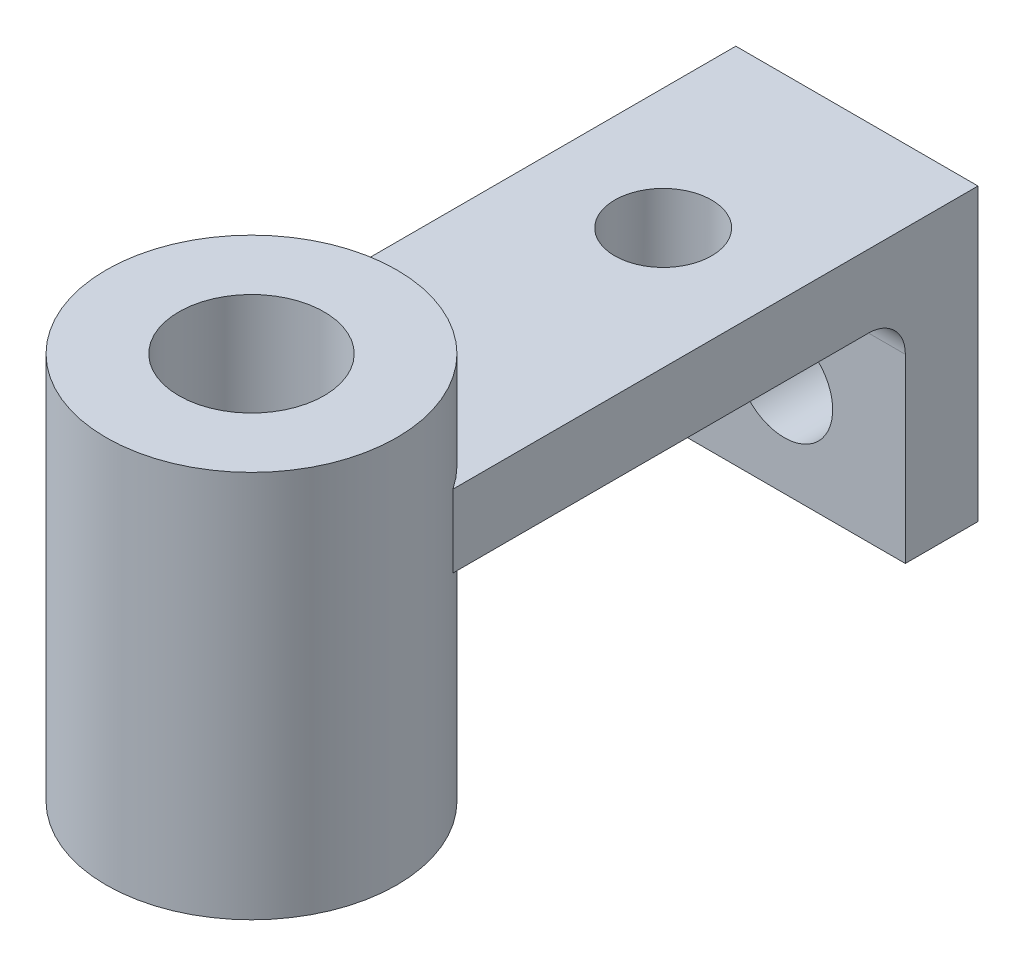
from build123d import *

# Parameters (mm, degrees)
SALIENTE_EXTRUIR1_DEPTH      = 31.75
CORTAR_EXTRUIR1_REACH        = 93.76
CROQUIS5_R                   = 6.35
CORTAR_EXTRUIR2_REACH        = 65.52
CROQUIS6_R                   = 6.35
SALIENTE_EXTRUIR2_DEPTH      = 12.7
SALIENTE_EXTRUIR2_DEPTH_BACK = 38.1
CROQUIS7_R                   = 19.05
CROQUIS8_R                   = 9.525
CORTAR_EXTRUIR3_DEPTH        = 86.149806408


with BuildPart() as part:
    # Croquis3 → Saliente-Extruir1 (new body)
    with BuildSketch(Plane(origin=(0, 0, 0), x_dir=(0, 0, -1), z_dir=(1, 0, 0))):
        with BuildLine():
            Line((39.6875, 4.7625), (39.6875, -33.3375))
            Line((39.6875, -33.3375), (30.1625, -33.3375))
            Line((30.1625, -33.3375), (30.1625, -9.5885))
            ThreePointArc((30.1625, -9.5885), (28.748997326, -6.176002674), (25.3365, -4.7625))
            Line((25.3365, -4.7625), (-39.6875, -4.7625))
            Line((-39.6875, -4.7625), (-39.6875, 4.7625))
            Line((-39.6875, 4.7625), (39.6875, 4.7625))
        make_face()
    extrude(amount=SALIENTE_EXTRUIR1_DEPTH)

    # Croquis5 → Cortar-Extruir1 (cut, up to next)
    with BuildSketch(Plane(origin=(0, 0, -39.6875), x_dir=(-1, 0, 0), z_dir=(0, 0, -1)), mode=Mode.PRIVATE) as cortar_extruir1_sk1:
        with Locations((-15.875, -20.6375)):
            Circle(CROQUIS5_R)
    cortar_extruir1_tool1 = extrude(cortar_extruir1_sk1.sketch, amount=-CORTAR_EXTRUIR1_REACH, mode=Mode.PRIVATE) & part.part
    add(cortar_extruir1_tool1.solids().sort_by_distance((15.875, -20.6375, -39.6875))[0], mode=Mode.SUBTRACT)

    # Croquis6 → Cortar-Extruir2 (cut, up to next)
    with BuildSketch(Plane(origin=(0, 4.7625, 0), x_dir=(1, 0, 0), z_dir=(0, 1, 0)), mode=Mode.PRIVATE) as cortar_extruir2_sk1:
        with Locations(Location((15.875, 14.2875, 0), (0, 0, 270))):
            Circle(CROQUIS6_R)
    cortar_extruir2_tool1 = extrude(cortar_extruir2_sk1.sketch, amount=-CORTAR_EXTRUIR2_REACH, mode=Mode.PRIVATE) & part.part
    add(cortar_extruir2_tool1.solids().sort_by_distance((15.875, 4.7625, -14.2875))[0], mode=Mode.SUBTRACT)

    # Croquis7 → Saliente-Extruir2 (add, two sides: drawn at the far end of the back side and taken through both)
    with BuildSketch(Plane(origin=(0, 4.7625, 0), x_dir=(1, 0, 0), z_dir=(0, 1, 0)).offset(-SALIENTE_EXTRUIR2_DEPTH_BACK)):
        with Locations(Location((15.875, -39.6875, 0), (0, 0, 270))):
            Circle(CROQUIS7_R)
    extrude(amount=SALIENTE_EXTRUIR2_DEPTH + SALIENTE_EXTRUIR2_DEPTH_BACK)

    # Croquis8 → Cortar-Extruir3 (cut, through all)
    with BuildSketch(Plane(origin=(0, 17.4625, 0), x_dir=(1, 0, 0), z_dir=(0, 1, 0))):
        with Locations(Location((15.875, -39.6875, 0), (0, 0, 270))):
            Circle(CROQUIS8_R)
    extrude(amount=-CORTAR_EXTRUIR3_DEPTH, mode=Mode.SUBTRACT)


solid = part.part
